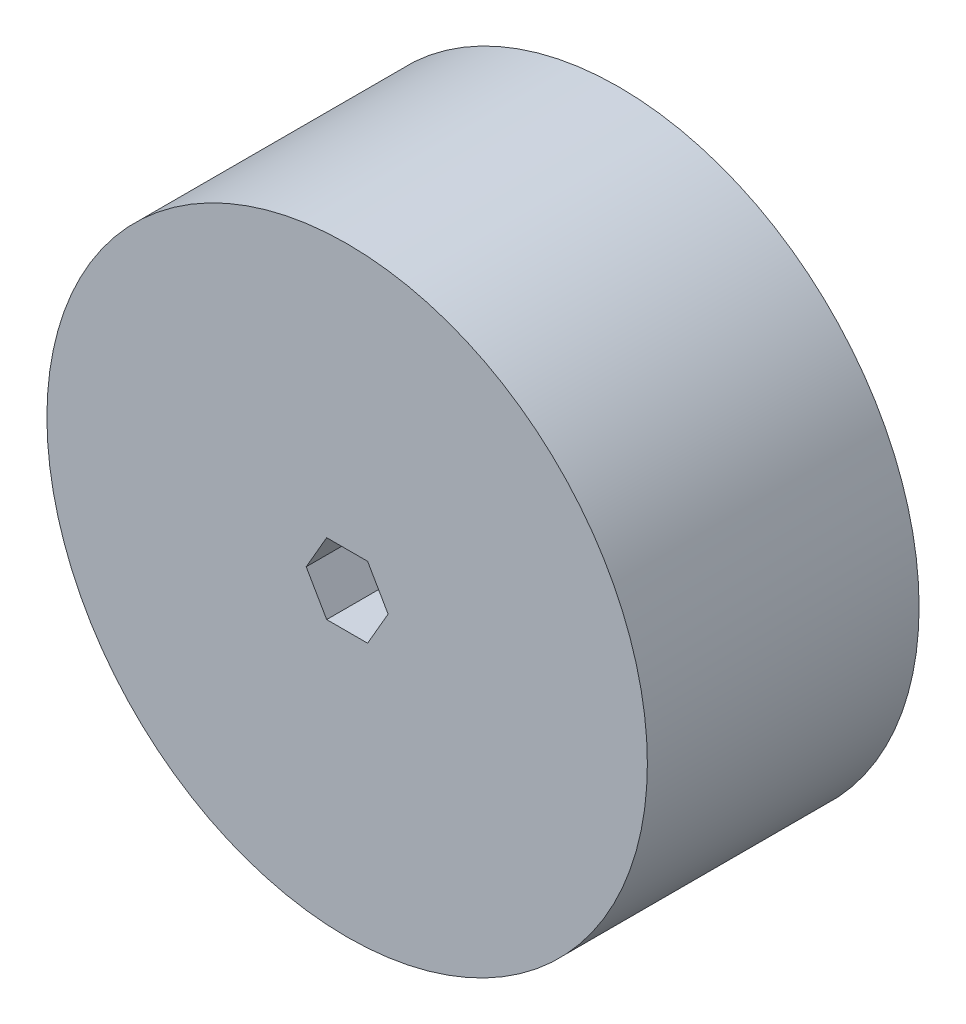
from build123d import *

# Parameters (mm, degrees)
SKETCH1_R           = 50.8
SKETCH1_R_2         = 6.92820323
BOSS_EXTRUDE1_DEPTH = 45.974
SKETCH2_R           = 38.1
CUT_EXTRUDE1_DEPTH  = 25.4


with BuildPart() as part:
    # Sketch1 → Boss-Extrude1 (new body)
    # profile 1 of 7: a face of its own
    with BuildSketch(Plane.XY):
        Circle(SKETCH1_R)
        Circle(SKETCH1_R_2, mode=Mode.SUBTRACT)
    # profile 2 of 7: a face of its own
    with BuildSketch(Plane.XY):
        with BuildLine():
            Line((-3.464101615, -6), (-6.92820323, 0))
            ThreePointArc((-6.92820323, 0), (-6, -3.464101615), (-3.464101615, -6))
        make_face()
    # profile 3 of 7: a face of its own
    with BuildSketch(Plane.XY):
        with BuildLine():
            Line((-6.92820323, 0), (-3.464101615, 6))
            ThreePointArc((-3.464101615, 6), (-6, 3.464101615), (-6.92820323, 0))
        make_face()
    # profile 4 of 7: a face of its own
    with BuildSketch(Plane.XY):
        with BuildLine():
            ThreePointArc((3.464101615, 6), (0, 6.92820323), (-3.464101615, 6))
            Line((-3.464101615, 6), (3.464101615, 6))
        make_face()
    # profile 5 of 7: a face of its own
    with BuildSketch(Plane.XY):
        with BuildLine():
            ThreePointArc((6.92820323, 0), (6, 3.464101615), (3.464101615, 6))
            Line((3.464101615, 6), (6.92820323, 0))
        make_face()
    # profile 6 of 7: a face of its own
    with BuildSketch(Plane.XY):
        with BuildLine():
            ThreePointArc((3.464101615, -6), (6, -3.464101615), (6.92820323, 0))
            Line((6.92820323, 0), (3.464101615, -6))
        make_face()
    # profile 7 of 7: a face of its own
    with BuildSketch(Plane.XY):
        with BuildLine():
            Line((3.464101615, -6), (-3.464101615, -6))
            ThreePointArc((-3.464101615, -6), (0, -6.92820323), (3.464101615, -6))
        make_face()
    extrude(amount=BOSS_EXTRUDE1_DEPTH)

    # Sketch2 → Cut-Extrude1 (cut)
    with BuildSketch(Plane.XY):
        Circle(SKETCH2_R)
    extrude(amount=CUT_EXTRUDE1_DEPTH, mode=Mode.SUBTRACT)


solid = part.part
